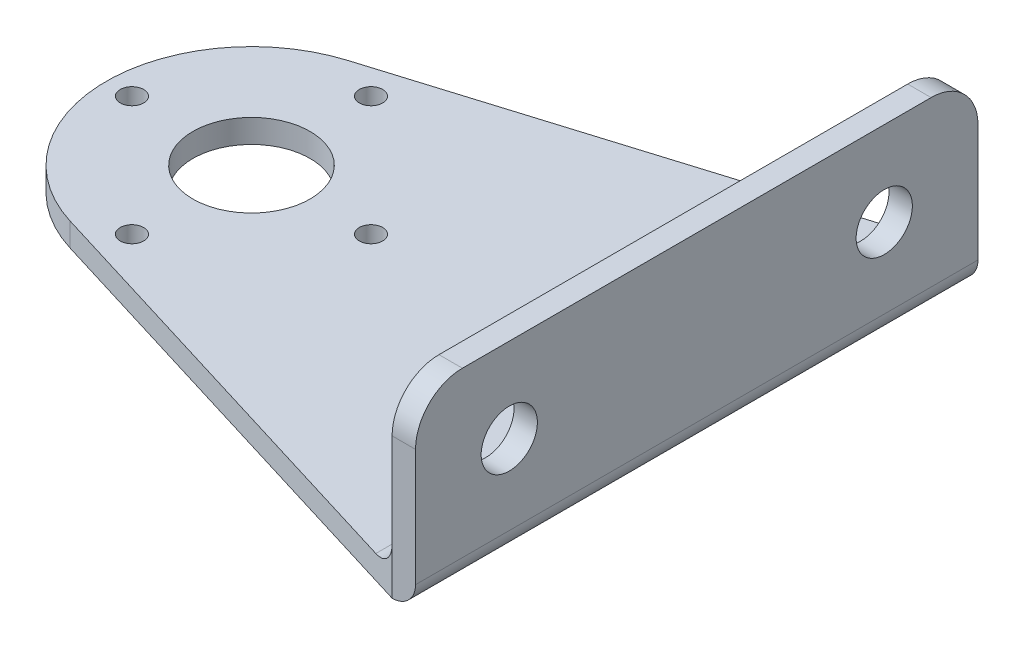
from build123d import *

# Parameters (mm, degrees)
SKETCH1_R           = 2.5
SKETCH1_R_2         = 12.5
BOSS_EXTRUDE1_DEPTH = 5
BOSS_EXTRUDE2_DEPTH = 5
FILLET1_R           = 5
SKETCH3_R           = 6
CUT_EXTRUDE1_DEPTH  = 10


with BuildPart() as part:
    # Sketch1 → Boss-Extrude1 (new body)
    with BuildSketch(Plane(origin=(0, 0, 0), x_dir=(1, 0, 0), z_dir=(0, 1, 0))):
        with BuildLine():
            Line((90, 60), (90, -60))
            Line((90, -60), (-9.08206944, -29.639770827))
            ThreePointArc((-9.08206944, -29.639770827), (-31, 0), (-9.08206944, 29.639770827))
            Line((-9.08206944, 29.639770827), (90, 60))
        make_face()
        with Locations(Location((0, 25.5, 0), (0, 0, 270))):
            Circle(SKETCH1_R, mode=Mode.SUBTRACT)
        with Locations(Location((-25.5, 0, 0), (0, 0, 270))):
            Circle(SKETCH1_R, mode=Mode.SUBTRACT)
        with Locations(Location((25.5, 0, 0), (0, 0, 270))):
            Circle(SKETCH1_R, mode=Mode.SUBTRACT)
        with Locations(Location((0, -25.5, 0), (0, 0, 270))):
            Circle(SKETCH1_R, mode=Mode.SUBTRACT)
        with Locations(Location((0, 0, 0), (0, 0, 270))):
            Circle(SKETCH1_R_2, mode=Mode.SUBTRACT)
    extrude(amount=BOSS_EXTRUDE1_DEPTH)

    # Sketch2 → Boss-Extrude2 (add)
    with BuildSketch(Plane(origin=(90, 0, 0), x_dir=(0, 0, -1), z_dir=(1, 0, 0))):
        with BuildLine():
            Line((-60, 0), (60, 0))
            Line((60, 0), (60, 30))
            ThreePointArc((60, 30), (57.071067812, 37.071067812), (50, 40))
            Line((50, 40), (-50, 40))
            ThreePointArc((-50, 40), (-57.071067812, 37.071067812), (-60, 30))
            Line((-60, 30), (-60, 0))
        make_face()
    extrude(amount=BOSS_EXTRUDE2_DEPTH)

    # Fillet1
    fillet1_edges = [part.edges().sort_by_distance(p)[0] for p in [
        (95, 0, 0),
        (90, 5, 0),
    ]]
    fillet(fillet1_edges, radius=FILLET1_R)

    # Sketch3 → Cut-Extrude1 (cut)
    with BuildSketch(Plane(origin=(95, 0, 0), x_dir=(0, 0, -1), z_dir=(1, 0, 0))):
        with Locations((-40, 22)):
            Circle(SKETCH3_R)
        with Locations((40, 22)):
            Circle(SKETCH3_R)
    extrude(amount=-CUT_EXTRUDE1_DEPTH, mode=Mode.SUBTRACT)


solid = part.part
